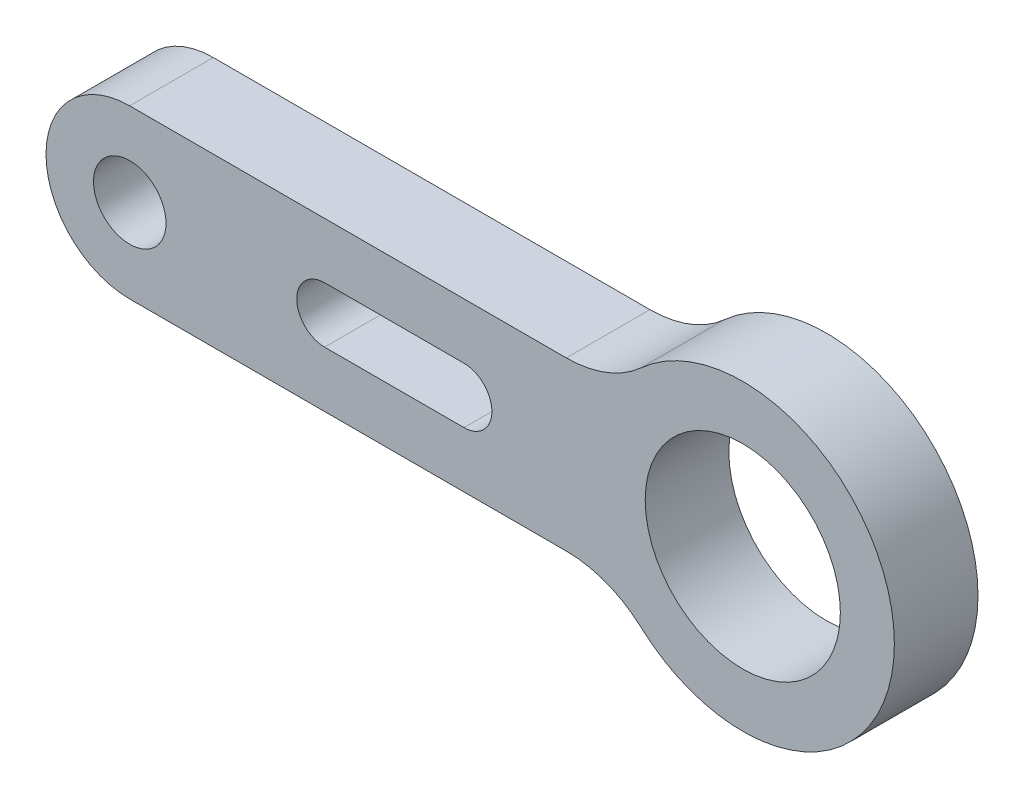
from build123d import *

# Parameters (mm, degrees)
SKETCH_1_R      = 1.3
SKETCH_1_R_2    = 3.5
EXTRUDE_1_DEPTH = 3


with BuildPart() as part:
    # 草图1 → 凸台-拉伸1 (new body)
    with BuildSketch(Plane(origin=(0, 0, 0), x_dir=(-1, 0, 0), z_dir=(0, 0, -1))):
        with BuildLine():
            Line((-17.544137719, 0.907119873), (-1.879793686, 0.907119873))
            ThreePointArc((-1.879793686, 0.907119873), (1.120206314, 3.907119873), (-1.879793686, 6.907119873))
            Line((-1.879793686, 6.907119873), (-17.542771769, 6.907119873))
            ThreePointArc((-17.542771769, 6.907119873), (-18.980357333, 7.174379894), (-20.225838323, 7.940446))
            ThreePointArc((-20.225838323, 7.940446), (-29.310375688, 3.908267946), (-20.226625317, -0.125682749))
            ThreePointArc((-20.226625317, -0.125682749), (-18.981359081, 0.640000095), (-17.544137719, 0.907119873))
        make_face()
        with Locations(Location((-1.88402906, 3.907119873, 0), (0, 0, 180))):
            Circle(SKETCH_1_R, mode=Mode.SUBTRACT)
        with Locations(Location((-23.87302906, 3.907737435, 0), (0, 0, 180))):
            Circle(SKETCH_1_R_2, mode=Mode.SUBTRACT)
        with BuildLine():
            Line((-8.87402906, 2.907386497), (-13.87402906, 2.907386497))
            ThreePointArc((-13.87402906, 2.907386497), (-14.87402906, 3.907386497), (-13.87402906, 4.907386497))
            Line((-13.87402906, 4.907386497), (-8.87402906, 4.907386497))
            ThreePointArc((-8.87402906, 4.907386497), (-7.87402906, 3.907386497), (-8.87402906, 2.907386497))
        make_face(mode=Mode.SUBTRACT)
    extrude(amount=-EXTRUDE_1_DEPTH)


solid = part.part
